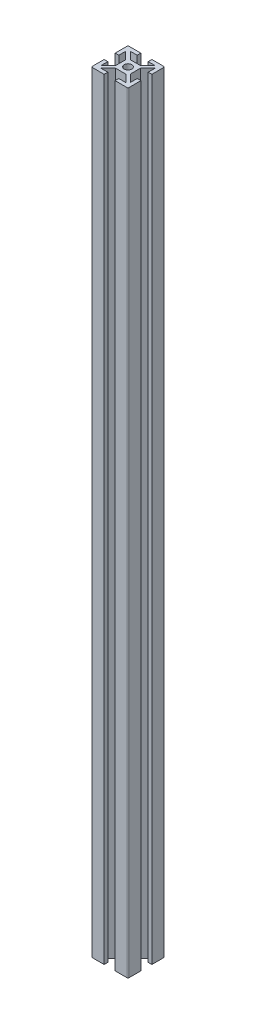
from build123d import *

# Parameters (mm, degrees)
SKETCH1_R           = 2.1
BOSS_EXTRUDE1_DEPTH = 420


with BuildPart() as part:
    # Sketch1 → Boss-Extrude1 (new body)
    with BuildSketch(Plane(origin=(0, 420, 0), x_dir=(1, 0, 0), z_dir=(0, 1, 0))):
        with BuildLine():
            Line((4, 2.746364236), (8, 6.746364236))
            Line((8, 6.746364236), (8, 3))
            Line((8, 3), (10, 3))
            Line((10, 3), (10, 9.5))
            ThreePointArc((10, 9.5), (9.853553391, 9.853553391), (9.5, 10))
            Line((9.5, 10), (3, 10))
            Line((3, 10), (3, 8))
            Line((3, 8), (6.863334179, 8))
            Line((6.863334179, 8), (2.863334179, 4))
            Line((2.863334179, 4), (-2.75, 4))
            Line((-2.75, 4), (-6.75, 8))
            Line((-6.75, 8), (-3, 8))
            Line((-3, 8), (-3, 10))
            Line((-3, 10), (-9.5, 10))
            ThreePointArc((-9.5, 10), (-9.853553391, 9.853553391), (-10, 9.5))
            Line((-10, 9.5), (-10, 3))
            Line((-10, 3), (-8, 3))
            Line((-8, 3), (-8, 6.75))
            Line((-8, 6.75), (-4, 2.75))
            Line((-4, 2.75), (-4, -2.75))
            Line((-4, -2.75), (-8, -6.75))
            Line((-8, -6.75), (-8, -3))
            Line((-8, -3), (-10, -3))
            Line((-10, -3), (-10, -9.5))
            ThreePointArc((-10, -9.5), (-9.853553391, -9.853553391), (-9.5, -10))
            Line((-9.5, -10), (-3, -10))
            Line((-3, -10), (-3, -8))
            Line((-3, -8), (-6.75, -8))
            Line((-6.75, -8), (-2.75, -4))
            Line((-2.75, -4), (2.868469119, -4))
            Line((2.868469119, -4), (6.868469119, -8))
            Line((6.868469119, -8), (3, -8))
            Line((3, -8), (3, -10))
            Line((3, -10), (9.5, -10))
            ThreePointArc((9.5, -10), (9.853553391, -9.853553391), (10, -9.5))
            Line((10, -9.5), (10, -3))
            Line((10, -3), (8, -3))
            Line((8, -3), (8, -6.665189266))
            Line((8, -6.665189266), (4, -2.665189266))
            Line((4, -2.665189266), (4, 2.746364236))
        make_face()
        with Locations(Location((0, 0, 0), (0, 0, 90))):
            Circle(SKETCH1_R, mode=Mode.SUBTRACT)
    extrude(amount=-BOSS_EXTRUDE1_DEPTH)


solid = part.part
